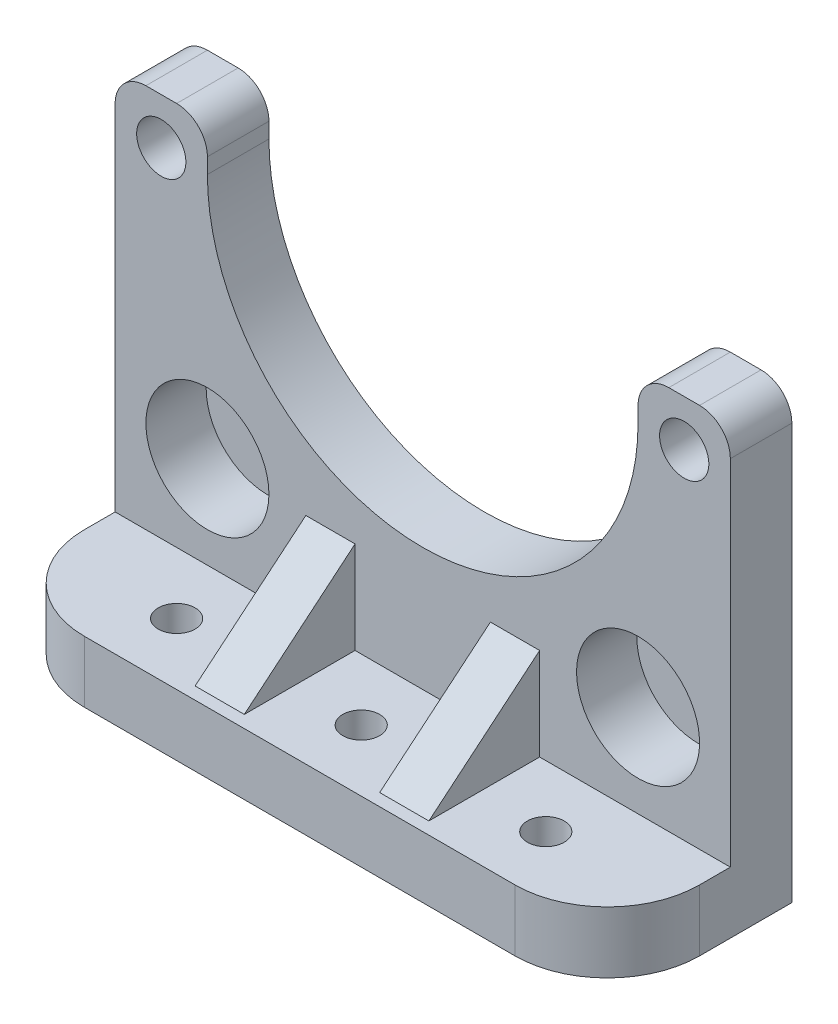
from build123d import *

# Parameters (mm, degrees)
SKETCH1_W           = 100
SKETCH1_H           = 72.5
BOSS_EXTRUDE1_DEPTH = 10
CUT_EXTRUDE1_DEPTH  = 10
SKETCH3_W           = 100
SKETCH3_H           = 10
FEET_DEPTH          = 20
SKETCH4_R           = 3
FEET_HOLE_DEPTH     = 10
SKETCH6_W           = 8
SKETCH6_H           = 15
BOSS_EXTRUDE2_DEPTH = 18
CUT_EXTRUDE2_DEPTH  = 105.485644947
SKETCH5_R           = 4
SKETCH5_R_2         = 10
CUT_EXTRUDE3_DEPTH  = 9.8
FILLET1_R           = 5
FILLET2_R           = 15


with BuildPart() as part:
    # Sketch1 → Boss-Extrude1 (new body)
    with BuildSketch(Plane.XY):
        with Locations((50, 36.25)):
            Rectangle(SKETCH1_W, SKETCH1_H)
    extrude(amount=BOSS_EXTRUDE1_DEPTH)

    # Sketch2 → Cut-Extrude1 (cut)
    with BuildSketch(Plane.XY.offset(10)):
        with BuildLine():
            Line((85, 65), (85, 72.5))
            Line((85, 72.5), (15, 72.5))
            Line((15, 72.5), (15, 65))
            ThreePointArc((15, 65), (50, 30), (85, 65))
        make_face()
    extrude(amount=-CUT_EXTRUDE1_DEPTH, mode=Mode.SUBTRACT)

    # Sketch3 → feet (add)
    with BuildSketch(Plane.XY.offset(10)):
        with Locations((50, 5)):
            Rectangle(SKETCH3_W, SKETCH3_H)
    extrude(amount=FEET_DEPTH)

    # Sketch4 → feet-hole (cut)
    with BuildSketch(Plane.XZ):
        with Locations(Location((20, 20, 0), (0, 0, 270))):
            Circle(SKETCH4_R)
        with Locations(Location((80, 20, 0), (0, 0, 270))):
            Circle(SKETCH4_R)
        with Locations(Location((50, 20, 0), (0, 0, 270))):
            Circle(SKETCH4_R)
    extrude(amount=-FEET_HOLE_DEPTH, mode=Mode.SUBTRACT)

    # Sketch6 → Boss-Extrude2 (add)
    with BuildSketch(Plane.XY.offset(10)):
        with Locations((35, 17.5)):
            Rectangle(SKETCH6_W, SKETCH6_H)
        with Locations((65, 17.5)):
            Rectangle(SKETCH6_W, SKETCH6_H)
    extrude(amount=BOSS_EXTRUDE2_DEPTH)

    # Sketch7 → Cut-Extrude2 (cut, through all)
    with BuildSketch(Plane.ZY.offset(-31)):
        Polygon((10, 25), (28, 10), (28, 25), align=None)
    extrude(amount=-CUT_EXTRUDE2_DEPTH, mode=Mode.SUBTRACT)

    # Sketch5 → Cut-Extrude3 (cut)
    with BuildSketch(Plane.XY.offset(10)):
        with Locations((7.5, 65)):
            Circle(SKETCH5_R)
        with Locations(Location((92.5, 65, 0), (0, 0, 180))):
            Circle(SKETCH5_R)
        with Locations((15, 25)):
            Circle(SKETCH5_R_2)
        with Locations(Location((85, 25, 0), (0, 0, 180))):
            Circle(SKETCH5_R_2)
    extrude(amount=-CUT_EXTRUDE3_DEPTH, mode=Mode.SUBTRACT)

    # Fillet1
    fillet1_edges = [part.edges().sort_by_distance(p)[0] for p in [
        (0, 72.5, 5),
        (15, 72.5, 5),
        (85, 72.5, 5),
        (100, 72.5, 5),
    ]]
    fillet(fillet1_edges, radius=FILLET1_R)

    # Fillet2
    fillet2_edges = [part.edges().sort_by_distance(p)[0] for p in [
        (0, 5, 30),
        (100, 5, 30),
    ]]
    fillet(fillet2_edges, radius=FILLET2_R)


solid = part.part
